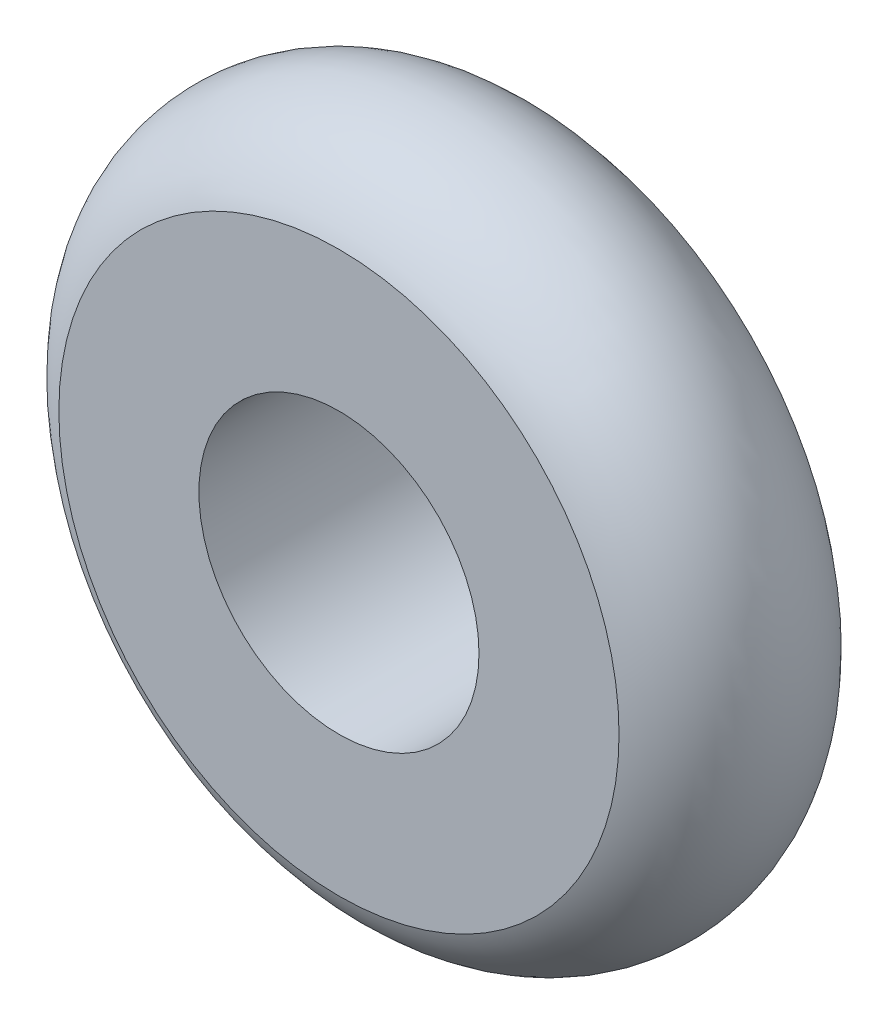
from build123d import *


with BuildPart() as part:
    # 草图1 → 旋转1 (revolve)
    with BuildSketch(Plane(origin=(0, 0, 0), x_dir=(1, 0, 0), z_dir=(0, 1, 0))):
        with BuildLine():
            Line((4, 3), (8, 3))
            ThreePointArc((8, 3), (10, 0), (8, -3))
            Line((8, -3), (4, -3))
            Line((4, -3), (4, 3))
        make_face()
    revolve(axis=Axis((0, 0, 0), (0, 0, -1)))


solid = part.part
